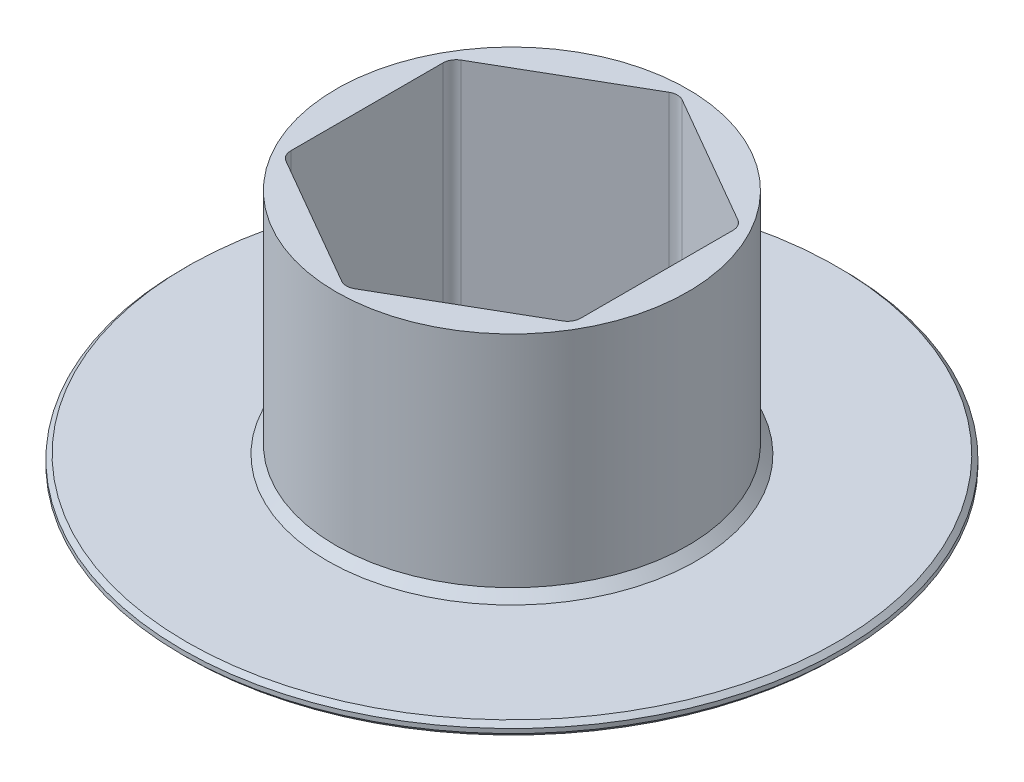
from build123d import *

# Parameters (mm, degrees)
SKETCH1_R           = 75
BOSS_EXTRUDE1_DEPTH = 3
SKETCH1_3_R         = 40
BOSS_EXTRUDE2_DEPTH = 55
SKETCH2_R           = 26
CUT_EXTRUDE1_DEPTH  = 119.127050247
FILLET1_R           = 3
CHAMFER2_SIZE       = 2
CHAMFER3_SIZE       = 2
CHAMFER4_SIZE       = 1
SKETCH3_R           = 26
BOSS_EXTRUDE3_DEPTH = 17
FILLET3_R           = 3


with BuildPart() as part:
    # Sketch1 → Boss-Extrude1 (new body)
    with BuildSketch(Plane(origin=(0, 0, 0), x_dir=(1, 0, 0), z_dir=(0, 1, 0))):
        Circle(SKETCH1_R)
    extrude(amount=BOSS_EXTRUDE1_DEPTH)

    # Sketch1<3> → Boss-Extrude2 (add)
    with BuildSketch(Plane(origin=(0, 0, 0), x_dir=(1, 0, 0), z_dir=(0, 1, 0))):
        Circle(SKETCH1_3_R)
        Polygon((33, 19.052558883), (33, -19.052558883), (0, -38.105117767), (-33, -19.052558883), (-33, 19.052558883), (0, 38.105117767), align=None, mode=Mode.SUBTRACT)
    extrude(amount=BOSS_EXTRUDE2_DEPTH)

    # Sketch2 → Cut-Extrude1 (cut, through all)
    with BuildSketch(Plane(origin=(0, 3, 0), x_dir=(1, 0, 0), z_dir=(0, 1, 0))):
        Circle(SKETCH2_R)
    extrude(amount=-CUT_EXTRUDE1_DEPTH, mode=Mode.SUBTRACT)

    # Fillet1
    fillet1_edges = [part.edges().sort_by_distance(p)[0] for p in [
        (33, 29, 19.052558883),
        (0, 29, 38.105117767),
        (-33, 29, 19.052558883),
        (-33, 29, -19.052558883),
        (0, 29, -38.105117767),
        (33, 29, -19.052558883),
    ]]
    fillet(fillet1_edges, radius=FILLET1_R)

    # Chamfer2
    chamfer2_edges = [part.edges().sort_by_distance(p)[0] for p in [
        (-16.5, 3, -28.578838325),
        (0, 3, -37.641016151),
        (-32.598076211, 3, -18.820508076),
        (16.5, 3, -28.578838325),
        (-33, 3, 0),
        (32.598076211, 3, -18.820508076),
        (-32.598076211, 3, 18.820508076),
        (33, 3, 0),
        (-16.5, 3, 28.578838325),
        (32.598076211, 3, 18.820508076),
        (0, 3, 37.641016151),
        (16.5, 3, 28.578838325),
    ]]
    chamfer(chamfer2_edges, length=CHAMFER2_SIZE)

    # Chamfer3
    chamfer3_edges = [part.edges().sort_by_distance(p)[0] for p in [
        (-40, 3, 0),
    ]]
    chamfer(chamfer3_edges, length=CHAMFER3_SIZE)

    # Chamfer4
    chamfer4_edges = [part.edges().sort_by_distance(p)[0] for p in [
        (-75, 3, 0),
        (-75, 0, 0),
    ]]
    chamfer(chamfer4_edges, length=CHAMFER4_SIZE)

    # Sketch3 → Boss-Extrude3 (add)
    with BuildSketch(Plane.XZ):
        Polygon((32.5, -18.763883749), (32.5, 18.763883749), (0, 37.527767497), (-32.5, 18.763883749), (-32.5, -18.763883749), (0, -37.527767497), align=None)
        Circle(SKETCH3_R, mode=Mode.SUBTRACT)
    extrude(amount=BOSS_EXTRUDE3_DEPTH)

    # Fillet3
    fillet3_edges = [part.edges().sort_by_distance(p)[0] for p in [
        (32.5, -8.5, -18.763883749),
        (32.5, -8.5, 18.763883749),
        (0, -8.5, 37.527767497),
        (-32.5, -8.5, 18.763883749),
        (-32.5, -8.5, -18.763883749),
        (0, -8.5, -37.527767497),
    ]]
    fillet(fillet3_edges, radius=FILLET3_R)


solid = part.part
